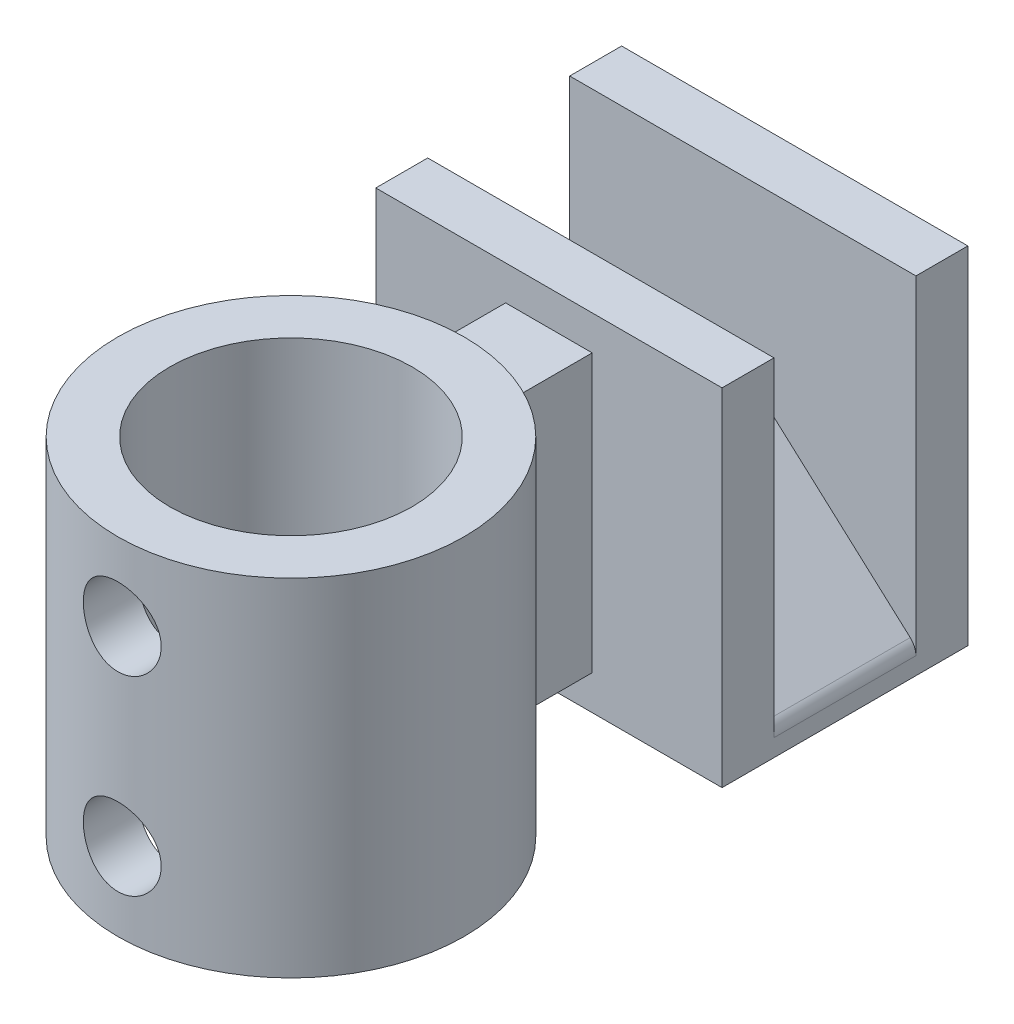
from build123d import *

# Parameters (mm, degrees)
SKETCH2_W                       = 20
SKETCH2_H                       = 10
BOSS_EXTRUDE1_DEPTH             = 4.1
CHAMFER1_SIZE                   = 9.5
CHAMFER1_SIZE2                  = 8.553838421
FILLET3_R                       = 1
SKETCH3_W                       = 20
SKETCH3_H                       = 20
BOSS_EXTRUDE2_DEPTH             = 3
BOSS_EXTRUDE3_REACH             = 21.375
SKETCH6_R                       = 10
SKETCH6_R_2                     = 7
BOSS_EXTRUDE3_DIRECTION_2_REACH = 21.375
BOSS_EXTRUDE4_REACH             = 32.741
BOSS_EXTRUDE4_END_RADIUS        = 10
SKETCH5_W                       = 5
SKETCH5_H                       = 16
CUT_EXTRUDE1_REACH              = 34.549
CUT_EXTRUDE1_END_RADIUS         = 10
SKETCH7_R                       = 2.25


with BuildPart() as part:
    # Sketch2 → Boss-Extrude1 (new, symmetric)
    with BuildSketch(Plane.XY):
        Rectangle(SKETCH2_W, SKETCH2_H)
    extrude(amount=BOSS_EXTRUDE1_DEPTH, both=True)

    # Chamfer1
    chamfer1_edges = [part.edges().sort_by_distance(p)[0] for p in [
        (-10, 5, 0),
        (10, 5, 0),
    ]]
    chamfer1_side = [part.faces().sort_by_distance(p)[0] for p in [
        (0, 5, 0),
    ]]
    chamfer(chamfer1_edges, length=CHAMFER1_SIZE, length2=CHAMFER1_SIZE2, reference=chamfer1_side[0])

    # Fillet3
    fillet3_edges = [part.edges().sort_by_distance(p)[0] for p in [
        (-0.5, 5, 0),
        (0.5, 5, 0),
        (10, -3.553838421, 0),
        (-10, -3.553838421, 0),
    ]]
    fillet(fillet3_edges, radius=FILLET3_R)

    # Sketch3 → Boss-Extrude2 (add)
    with BuildSketch(Plane.XY.offset(4.1)):
        with Locations((0, 5)):
            Rectangle(SKETCH3_W, SKETCH3_H)
    boss_extrude2 = extrude(amount=BOSS_EXTRUDE2_DEPTH)

    # Mirror1: Boss-Extrude2 across plane
    add(boss_extrude2.mirror(Plane.XY))


with BuildPart() as body_2:

    # Boss-Extrude3: up to this face of the body (flat: up to its plane)
    boss_extrude3_end = Plane(part.part.faces().sort_by_distance((0, 15, 5.6))[0])
    # Sketch6 → Boss-Extrude3 (new, up to the picked face)
    with BuildSketch(Plane(origin=(0, 0, 0), x_dir=(1, 0, 0), z_dir=(0, 1, 0)), mode=Mode.PRIVATE) as boss_extrude3_sk1:
        with Locations(Location((0, -22, 0), (0, 0, 90))):
            Circle(SKETCH6_R)
        with Locations(Location((0, -22, 0), (0, 0, 90))):
            Circle(SKETCH6_R_2, mode=Mode.SUBTRACT)
    boss_extrude3_tool1 = split(extrude(boss_extrude3_sk1.sketch, amount=BOSS_EXTRUDE3_REACH, mode=Mode.PRIVATE), bisect_by=boss_extrude3_end, keep=Keep.BOTH, mode=Mode.PRIVATE)
    add(boss_extrude3_tool1.solids().sort_by(Axis((0, 0, 31.717157), (0, 1, 0)))[0])


    # Boss-Extrude3 direction 2: up to this face of the body (flat: up to its plane)
    boss_extrude3_direction_2_end = Plane(part.part.faces().sort_by_distance((0, -5, 0))[0])
    # Sketch6 → Boss-Extrude3 direction 2 (add, up to the picked face)
    with BuildSketch(Plane(origin=(0, 0, 0), x_dir=(1, 0, 0), z_dir=(0, 1, 0)), mode=Mode.PRIVATE) as boss_extrude3_direction_2_sk1:
        with Locations(Location((0, -22, 0), (0, 0, 90))):
            Circle(SKETCH6_R)
        with Locations(Location((0, -22, 0), (0, 0, 90))):
            Circle(SKETCH6_R_2, mode=Mode.SUBTRACT)
    boss_extrude3_direction_2_tool1 = split(extrude(boss_extrude3_direction_2_sk1.sketch, amount=-BOSS_EXTRUDE3_DIRECTION_2_REACH, mode=Mode.PRIVATE), bisect_by=boss_extrude3_direction_2_end, keep=Keep.BOTH, mode=Mode.PRIVATE)
    add(boss_extrude3_direction_2_tool1.solids().sort_by(Axis((0, 0, 31.717157), (0, -1, 0)))[0])


with BuildPart() as part_1:
    add(part.part)

    add(body_2.part)  # Boss-Extrude4 merges body 2
    # Boss-Extrude4: up to this cylinder (the profile starts outside it)
    boss_extrude4_end = Plane(origin=(0, 5, 22), z_dir=(0, -1, 0)) * Cylinder(BOSS_EXTRUDE4_END_RADIUS, 86.482, mode=Mode.PRIVATE)
    # Sketch5 → Boss-Extrude4 (add, up to the surface)
    with BuildSketch(Plane.XY.offset(7.1), mode=Mode.PRIVATE) as boss_extrude4_sk1:
        with Locations((0, 5)):
            Rectangle(SKETCH5_W, SKETCH5_H)
    boss_extrude4_tool1 = extrude(boss_extrude4_sk1.sketch, amount=BOSS_EXTRUDE4_REACH, mode=Mode.PRIVATE) - boss_extrude4_end
    add(boss_extrude4_tool1.solids().sort_by_distance((0, 5, 7.1))[0])

    # Cut-Extrude1: up to this cylinder (the profile starts inside it)
    cut_extrude1_end = Plane(origin=(0, 5, 22), z_dir=(0, -1, 0)) * Cylinder(CUT_EXTRUDE1_END_RADIUS, 101.098, mode=Mode.PRIVATE)
    # Sketch7 → Cut-Extrude1 (cut, up to the surface)
    with BuildSketch(Plane.XY.offset(20), mode=Mode.PRIVATE) as cut_extrude1_sk1:
        with Locations(Location((0, 10.5, 0), (0, 0, 180))):
            Circle(SKETCH7_R)
    cut_extrude1_tool1 = extrude(cut_extrude1_sk1.sketch, amount=CUT_EXTRUDE1_REACH, mode=Mode.PRIVATE) & cut_extrude1_end
    add(cut_extrude1_tool1.solids().sort_by_distance((0, 10.5, 20))[0], mode=Mode.SUBTRACT)
    # Sketch7 → Cut-Extrude1 (cut, up to the surface)
    with BuildSketch(Plane.XY.offset(20), mode=Mode.PRIVATE) as cut_extrude1_sk2:
        with Locations(Location((0, -0.5, 0), (0, 0, 180))):
            Circle(SKETCH7_R)
    cut_extrude1_tool2 = extrude(cut_extrude1_sk2.sketch, amount=CUT_EXTRUDE1_REACH, mode=Mode.PRIVATE) & cut_extrude1_end
    add(cut_extrude1_tool2.solids().sort_by_distance((0, -0.5, 20))[0], mode=Mode.SUBTRACT)


solid = part_1.part
